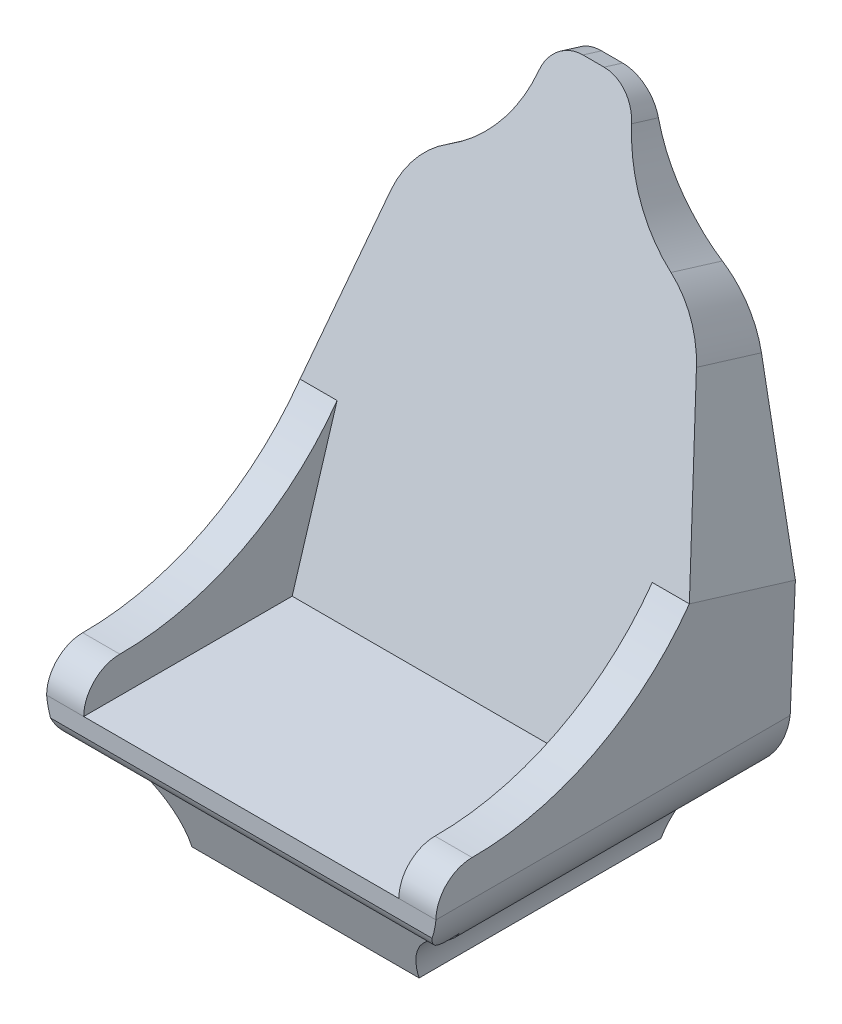
from build123d import *

# Parameters (mm, degrees)
SKETCH1_W           = 533.4
SKETCH1_H           = 508
SKETCH1_R           = 12.7
BOSS_EXTRUDE1_DEPTH = 152.4
BOSS_EXTRUDE2_DEPTH = 660.4
SKETCH4_OUTSIDE_W   = 729.384
SKETCH4_OUTSIDE_H   = 1034.184
CUT_EXTRUDE1_DEPTH  = 660.4
BOSS_EXTRUDE3_DEPTH = 50.8
SKETCH7_OUTSIDE_W   = 754.784
SKETCH7_OUTSIDE_H   = 1147.193
CUT_EXTRUDE2_DEPTH  = 254
CUT_EXTRUDE3_DEPTH  = 508


with BuildPart() as part:
    # Sketch1 → Boss-Extrude1 (new body)
    with BuildSketch(Plane(origin=(0, 0, 0), x_dir=(1, 0, 0), z_dir=(0, 1, 0))):
        Rectangle(SKETCH1_W, SKETCH1_H)
        with Locations((-95.25, -130.175)):
            Circle(SKETCH1_R, mode=Mode.SUBTRACT)
        with Locations((-95.25, 0)):
            Circle(SKETCH1_R, mode=Mode.SUBTRACT)
        with Locations((-95.25, 130.175)):
            Circle(SKETCH1_R, mode=Mode.SUBTRACT)
        with Locations((95.25, -130.175)):
            Circle(SKETCH1_R, mode=Mode.SUBTRACT)
        with Locations((95.25, 0)):
            Circle(SKETCH1_R, mode=Mode.SUBTRACT)
        with Locations((95.25, 130.175)):
            Circle(SKETCH1_R, mode=Mode.SUBTRACT)
    extrude(amount=BOSS_EXTRUDE1_DEPTH)

    # Sketch3 → Boss-Extrude2 (add)
    with BuildSketch(Plane(origin=(0, 152.4, 0), x_dir=(1, 0, 0), z_dir=(0, 1, 0))):
        Polygon((-266.7, 254), (-266.7, -254), (-165.1, -254), (165.1, -254), (266.7, -254), (266.7, 254), align=None)
    extrude(amount=BOSS_EXTRUDE2_DEPTH)

    # Sketch4 outside → Cut-Extrude1 (cut)
    with BuildSketch(Plane(origin=(266.7, 0, 0), x_dir=(0, 0, -1), z_dir=(1, 0, 0))):
        with Locations((0, 406.4)):
            Rectangle(SKETCH4_OUTSIDE_W, SKETCH4_OUTSIDE_H)
        with BuildLine():
            Line((228.6, 108.732858548), (254, 669.23901778))
            Line((254, 669.23901778), (254, 812.8))
            Line((254, 812.8), (228.6, 812.8))
            Line((228.6, 812.8), (31.606344145, 168.462784922))
            Line((31.606344145, 168.462784922), (-254, 168.462784922))
            ThreePointArc((-254, 168.462784922), (-243.936587472, 127.409322416), (-202.883124967, 117.345909888))
            Line((-202.883124967, 117.345909888), (-165.988990497, 0))
            Line((-165.988990497, 0), (165.353024922, 0))
            Line((165.353024922, 0), (228.6, 108.732858548))
        make_face(mode=Mode.SUBTRACT)
    extrude(amount=-CUT_EXTRUDE1_DEPTH, mode=Mode.SUBTRACT)

    # Sketch6 → Boss-Extrude3 (add)
    with BuildSketch(Plane.ZY.offset(266.7)):
        with BuildLine():
            Line((254, 168.462784922), (-31.606344145, 168.462784922))
            Line((-31.606344145, 168.462784922), (-93.174683572, 369.843749152))
            ThreePointArc((-93.174683572, 369.843749152), (37.15276036, 257.574854495), (204.490495991, 217.72978475))
            ThreePointArc((204.490495991, 217.72978475), (239.484222443, 203.385658011), (254, 168.462784922))
        make_face()
    boss_extrude3 = extrude(amount=-BOSS_EXTRUDE3_DEPTH)

    # Mirror1: Boss-Extrude3 across plane
    add(boss_extrude3.mirror(Plane.ZY))

    # Sketch7 outside → Cut-Extrude2 (cut)
    with BuildSketch(Plane(origin=(0, 5.563381647, 18.197001427), x_dir=(1, 0, 0), z_dir=(0, 0.29237170472274066, 0.9563047559630343))):
        with Locations((0, 388.6425)):
            Rectangle(SKETCH7_OUTSIDE_W, SKETCH7_OUTSIDE_H)
        with BuildLine():
            Line((-266.7, 380.92497735), (-209.55, 609.52497735))
            ThreePointArc((-209.55, 609.52497735), (-188.66895271, 653.395441882), (-152.4, 685.72497735))
            ThreePointArc((-152.4, 685.72497735), (-95.710918301, 736.501940936), (-63.5, 805.454161765))
            ThreePointArc((-63.5, 805.454161765), (-45.688148209, 833.291148022), (-14.465061194, 844.120677346))
            Line((-14.465061194, 844.120677346), (14.465061194, 844.120677346))
            ThreePointArc((14.465061194, 844.120677346), (45.688148209, 833.291148022), (63.5, 805.454161765))
            ThreePointArc((63.5, 805.454161765), (95.710918301, 736.501940936), (152.4, 685.72497735))
            ThreePointArc((152.4, 685.72497735), (188.66895271, 653.395441882), (209.55, 609.52497735))
            Line((209.55, 609.52497735), (266.7, 380.92497735))
            Line((266.7, 380.92497735), (266.7, -48.530484117))
            Line((266.7, -48.530484117), (-266.7, -48.530484117))
            Line((-266.7, -48.530484117), (-266.7, 380.92497735))
        make_face(mode=Mode.SUBTRACT)
    extrude(amount=-CUT_EXTRUDE2_DEPTH, mode=Mode.SUBTRACT)

    # Sketch10 → Cut-Extrude3 (cut)
    with BuildSketch(Plane.XY.offset(254)):
        with BuildLine():
            Line((-266.7, 168.462784922), (-387.417771375, 168.462784922))
            Line((-387.417771375, 168.462784922), (-387.417771375, 0))
            Line((-387.417771375, 0), (-155.638931275, 0))
            ThreePointArc((-155.638931275, 0), (-169.876966254, 49.659931769), (-208.265044728, 84.231392461))
            ThreePointArc((-208.265044728, 84.231392461), (-248.469302502, 118.725084742), (-266.7, 168.462784922))
        make_face()
        with BuildLine():
            Line((387.417771375, 0), (155.638931275, 0))
            ThreePointArc((155.638931275, 0), (169.876966254, 49.659931769), (208.265044728, 84.231392461))
            ThreePointArc((208.265044728, 84.231392461), (248.469302502, 118.725084742), (266.7, 168.462784922))
            Line((266.7, 168.462784922), (387.417771375, 168.462784922))
            Line((387.417771375, 168.462784922), (387.417771375, 0))
        make_face()
    extrude(amount=-CUT_EXTRUDE3_DEPTH, mode=Mode.SUBTRACT)


solid = part.part
